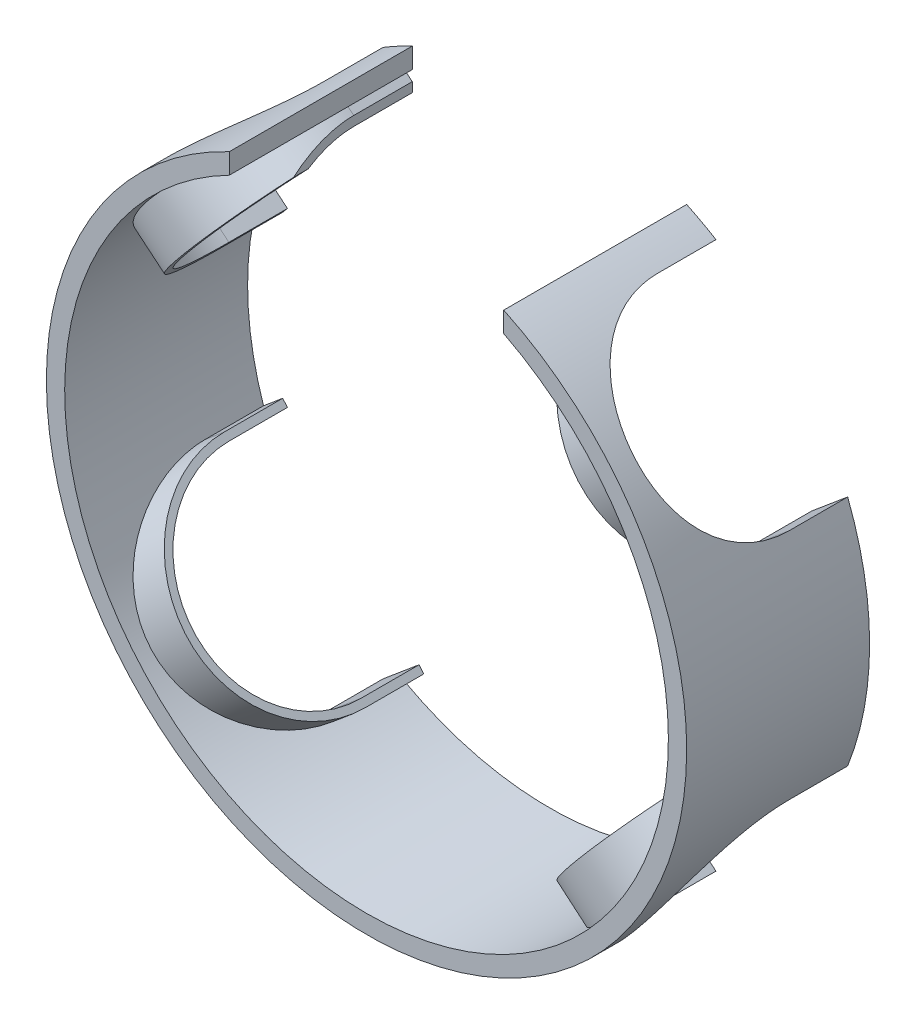
from build123d import *

# Parameters (mm, degrees)
SKETCH1_R                                     = 87.5
SKETCH1_R_2                                   = 82.5
BOSS_EXTRUDE1_DEPTH                           = 50
CUT_EXTRUDE1_DEPTH                            = 134.46347815
BOSS_EXTRUDE2_REACH                           = 201.927
BOSS_EXTRUDE2_END_RADIUS                      = 82.5
MIRROR1_AT_THE_SECOND_PLANE_COPY_1_DEPTH      = 134.46347815
MIRROR1_AT_THE_SECOND_PLANE_COPY_2_REACH      = 201.927
MIRROR1_AT_THE_SECOND_PLANE_COPY_2_END_RADIUS = 82.5
SKETCH4_W                                     = 75
SKETCH4_H                                     = 150.506250548
CUT_EXTRUDE2_DEPTH                            = 134.463478319


with BuildPart() as part:
    # Sketch1 → Boss-Extrude1 (new body)
    with BuildSketch(Plane.XY):
        Circle(SKETCH1_R)
        Circle(SKETCH1_R_2, mode=Mode.SUBTRACT)
    extrude(amount=BOSS_EXTRUDE1_DEPTH)

    # Sketch3 → Cut-Extrude1 (cut, through all)
    with BuildSketch(Plane(origin=(0, 0, 0), x_dir=(0, 0, 1), z_dir=(-0.7660444431189792, 0.6427876096865379, 0))):
        with BuildLine():
            Line((16, 28), (-21.315886337, 28))
            Line((-21.315886337, 28), (-21.315886337, -28))
            Line((-21.315886337, -28), (16, -28))
            ThreePointArc((16, -28), (44, 0), (16, 28))
        make_face()
    cut_extrude1 = extrude(amount=CUT_EXTRUDE1_DEPTH, mode=Mode.SUBTRACT)

    # Boss-Extrude2: up to this cylinder (the profile starts inside it)
    boss_extrude2_end = Plane(origin=(0, 0, 8), z_dir=(0, 0, -1)) * Cylinder(BOSS_EXTRUDE2_END_RADIUS, 569.854, mode=Mode.PRIVATE)
    # Sketch5 → Boss-Extrude2 (add, up to the surface)
    with BuildSketch(Plane(origin=(-53.623111018, 44.995132678, 0), x_dir=(0, 0, 1), z_dir=(-0.7660444431189792, 0.6427876096865379, 0)), mode=Mode.PRIVATE) as boss_extrude2_sk1:
        with BuildLine():
            Line((0, -28), (16, -28))
            ThreePointArc((16, -28), (44, 0), (16, 28))
            Line((16, 28), (0, 28))
            Line((0, 28), (0, 30))
            Line((0, 30), (16, 30))
            ThreePointArc((16, 30), (46, 0), (16, -30))
            Line((16, -30), (0, -30))
            Line((0, -30), (0, -28))
        make_face()
    boss_extrude2_tool1 = extrude(boss_extrude2_sk1.sketch, amount=BOSS_EXTRUDE2_REACH, mode=Mode.PRIVATE) & boss_extrude2_end
    boss_extrude2 = boss_extrude2_tool1.solids().sort_by_distance((-72.420765, 22.592961, 8))[0]
    add(boss_extrude2)

    # Mirror1: Cut-Extrude1, Boss-Extrude2 across plane
    add(cut_extrude1.mirror(Plane(origin=(0, 0, 0), x_dir=(0, 0, 1), z_dir=(1, 0, 0))), mode=Mode.SUBTRACT)
    add(boss_extrude2.mirror(Plane(origin=(0, 0, 0), x_dir=(0, 0, 1), z_dir=(1, 0, 0))))

    # Mirror1 at the second plane: Cut-Extrude1, Boss-Extrude2 across plane
    add(cut_extrude1.mirror(Plane.ZX), mode=Mode.SUBTRACT)
    add(boss_extrude2.mirror(Plane.ZX))

    # Mirror1 at the second plane copy 1 sketc → Mirror1 at the second plane copy 1 (cut, through all)
    with BuildSketch(Plane(origin=(0, 0, 0), x_dir=(0, 0, 1), z_dir=(0.7660444431189792, -0.6427876096865379, 0))):
        with BuildLine():
            Line((16, 28), (-21.315886337, 28))
            Line((-21.315886337, 28), (-21.315886337, -28))
            Line((-21.315886337, -28), (16, -28))
            ThreePointArc((16, -28), (44, 0), (16, 28))
        make_face()
    extrude(amount=MIRROR1_AT_THE_SECOND_PLANE_COPY_1_DEPTH, mode=Mode.SUBTRACT)

    # Mirror1 at the second plane copy 2: up to this cylinder (the profile starts inside it)
    mirror1_at_the_second_plane_copy_2_end = Plane(origin=(0, 0, 8), z_dir=(0, 0, -1)) * Cylinder(MIRROR1_AT_THE_SECOND_PLANE_COPY_2_END_RADIUS, 569.854, mode=Mode.PRIVATE)
    # Mirror1 at the second plane copy 2 sketc → Mirror1 at the second plane copy 2 (add, up to the surface)
    with BuildSketch(Plane(origin=(53.623111018, -44.995132678, 0), x_dir=(0, 0, 1), z_dir=(0.7660444431189792, -0.6427876096865379, 0)), mode=Mode.PRIVATE) as mirror1_at_the_second_plane_copy_2_sk1:
        with BuildLine():
            Line((0, -28), (16, -28))
            ThreePointArc((16, -28), (44, 0), (16, 28))
            Line((16, 28), (0, 28))
            Line((0, 28), (0, 30))
            Line((0, 30), (16, 30))
            ThreePointArc((16, 30), (46, 0), (16, -30))
            Line((16, -30), (0, -30))
            Line((0, -30), (0, -28))
        make_face()
    mirror1_at_the_second_plane_copy_2_tool1 = extrude(mirror1_at_the_second_plane_copy_2_sk1.sketch, amount=MIRROR1_AT_THE_SECOND_PLANE_COPY_2_REACH, mode=Mode.PRIVATE) & mirror1_at_the_second_plane_copy_2_end
    add(mirror1_at_the_second_plane_copy_2_tool1.solids().sort_by_distance((-72.420765, 22.592961, 8))[0])

    # Sketch4 → Cut-Extrude2 (cut, through all)
    with BuildSketch(Plane.XY.offset(50)):
        with Locations((0, 75.253125274)):
            Rectangle(SKETCH4_W, SKETCH4_H)
    extrude(amount=-CUT_EXTRUDE2_DEPTH, mode=Mode.SUBTRACT)


solid = part.part
